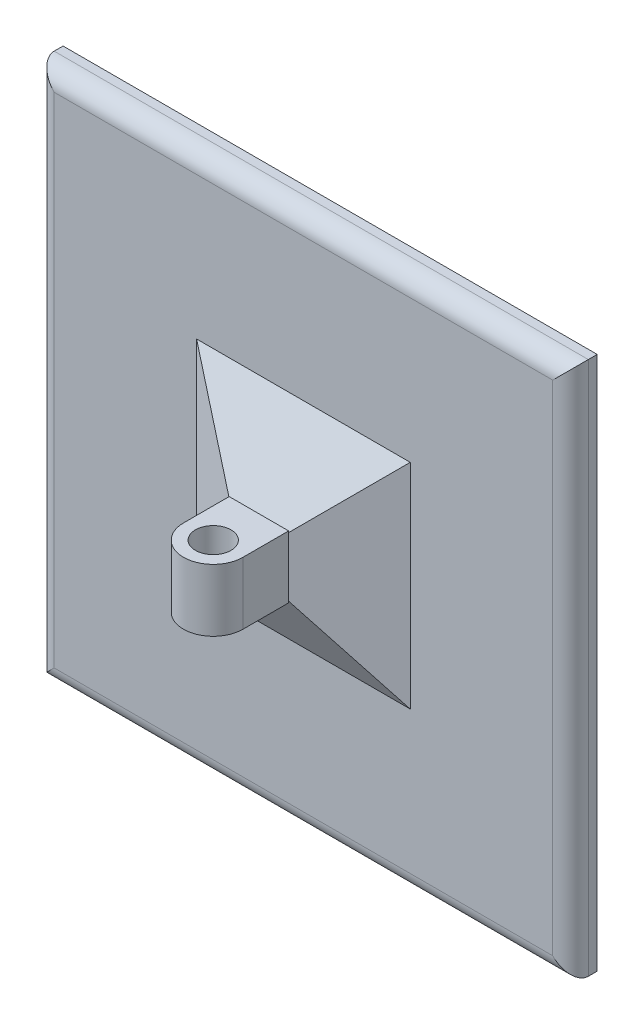
from build123d import *

# Parameters (mm, degrees)
CROQUIS1_W              = 60
CROQUIS1_H              = 60
SALIENTE_EXTRUIR1_DEPTH = 3
REDONDEO1_R             = 2
CROQUIS2_W              = 24
CROQUIS2_H              = 24
SALIENTE_EXTRUIR2_DEPTH = 5
SALIENTE_EXTRUIR2_TAPER = 60
SALIENTE_EXTRUIR3_DEPTH = 3.5
CROQUIS7_R              = 2
CORTAR_EXTRUIR1_DEPTH   = 7


with BuildPart() as part:
    # Croquis1 → Saliente-Extruir1 (new body)
    with BuildSketch(Plane.XY):
        Rectangle(CROQUIS1_W, CROQUIS1_H)
    extrude(amount=SALIENTE_EXTRUIR1_DEPTH)

    # Redondeo1
    redondeo1_edges = [part.edges().sort_by_distance(p)[0] for p in [
        (0, -30, 3),
        (-30, 0, 3),
        (30, 0, 3),
        (0, 30, 3),
    ]]
    fillet(redondeo1_edges, radius=REDONDEO1_R)

    # Croquis2 → Saliente-Extruir2 (add)
    with BuildSketch(Plane.XY.offset(3)):
        Rectangle(CROQUIS2_W, CROQUIS2_H)
    extrude(amount=SALIENTE_EXTRUIR2_DEPTH, taper=SALIENTE_EXTRUIR2_TAPER)

    # Croquis6 → Saliente-Extruir3 (add, symmetric)
    with BuildSketch(Plane(origin=(0, 0, 0), x_dir=(1, 0, 0), z_dir=(0, 1, 0))):
        with BuildLine():
            Line((-3.339745962, -8), (-3.339745962, -13.130693005))
            ThreePointArc((-3.339745962, -13.130693005), (0, -16.470438967), (3.339745962, -13.130693005))
            Line((3.339745962, -13.130693005), (3.339745962, -8))
            Line((3.339745962, -8), (-3.339745962, -8))
        make_face()
    extrude(amount=SALIENTE_EXTRUIR3_DEPTH, both=True)

    # Croquis7 → Cortar-Extruir1 (cut)
    with BuildSketch(Plane.XZ.offset(3.5)):
        with Locations((0, 13.130693005)):
            Circle(CROQUIS7_R)
    extrude(amount=-CORTAR_EXTRUIR1_DEPTH, mode=Mode.SUBTRACT)


solid = part.part
